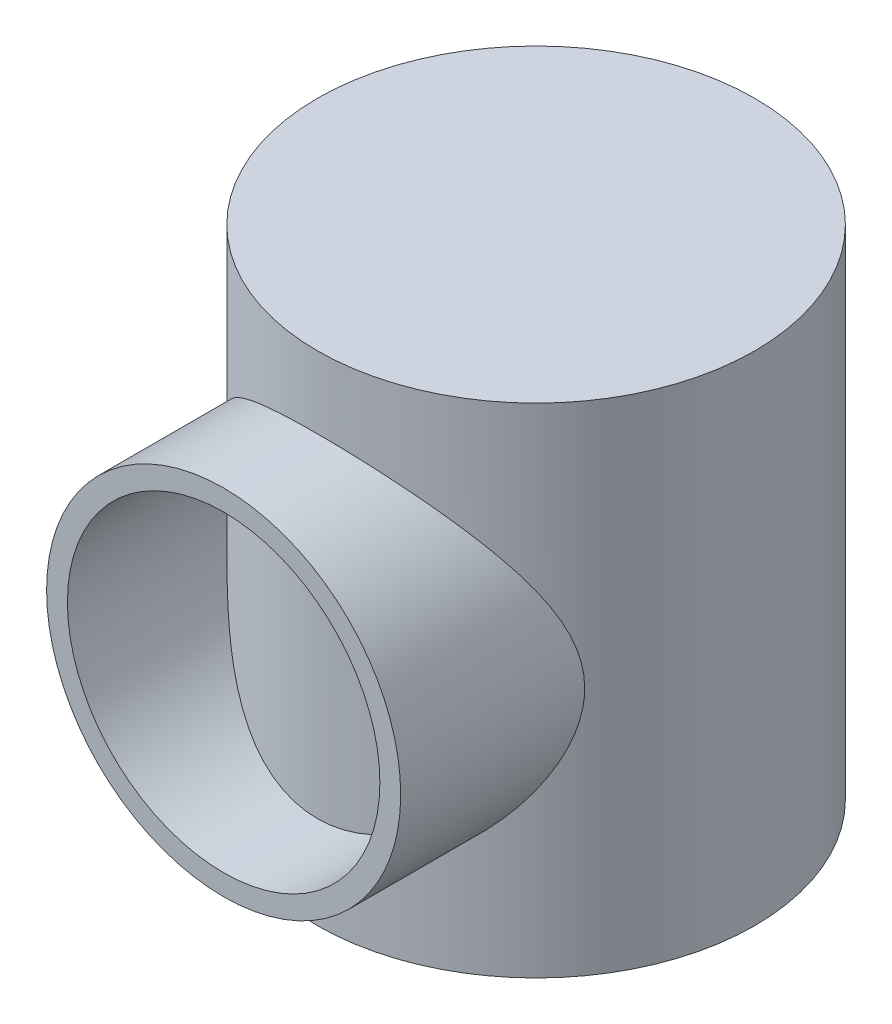
from build123d import *

# Parameters (mm, degrees)
SKETCH1_R                = 21
BOSS_EXTRUDE1_DEPTH      = 47.8
BOSS_EXTRUDE2_REACH      = 74.985
BOSS_EXTRUDE2_END_RADIUS = 21
SKETCH3_R                = 17
SKETCH3_R_2              = 15


with BuildPart() as part:
    # Sketch1 → Boss-Extrude1 (new body)
    with BuildSketch(Plane(origin=(0, 0, 0), x_dir=(1, 0, 0), z_dir=(0, 1, 0))):
        with Locations(Location((0, 0, 0), (0, 0, 90))):
            Circle(SKETCH1_R)
    extrude(amount=BOSS_EXTRUDE1_DEPTH)

    # Boss-Extrude2: up to this cylinder (the profile starts outside it)
    boss_extrude2_end = Plane(origin=(0, 23.9, 0), z_dir=(0, -1, 0)) * Cylinder(BOSS_EXTRUDE2_END_RADIUS, 192.97, mode=Mode.PRIVATE)
    # Sketch3 → Boss-Extrude2 (add, up to the surface)
    with BuildSketch(Plane.XY.offset(30), mode=Mode.PRIVATE) as boss_extrude2_sk1:
        with Locations((0, 23.9)):
            Circle(SKETCH3_R)
        with Locations((0, 23.9)):
            Circle(SKETCH3_R_2, mode=Mode.SUBTRACT)
    boss_extrude2_tool1 = extrude(boss_extrude2_sk1.sketch, amount=-BOSS_EXTRUDE2_REACH, mode=Mode.PRIVATE) - boss_extrude2_end
    add(boss_extrude2_tool1.solids().sort_by_distance((-16.519167, 23.9, 30))[0])


solid = part.part
